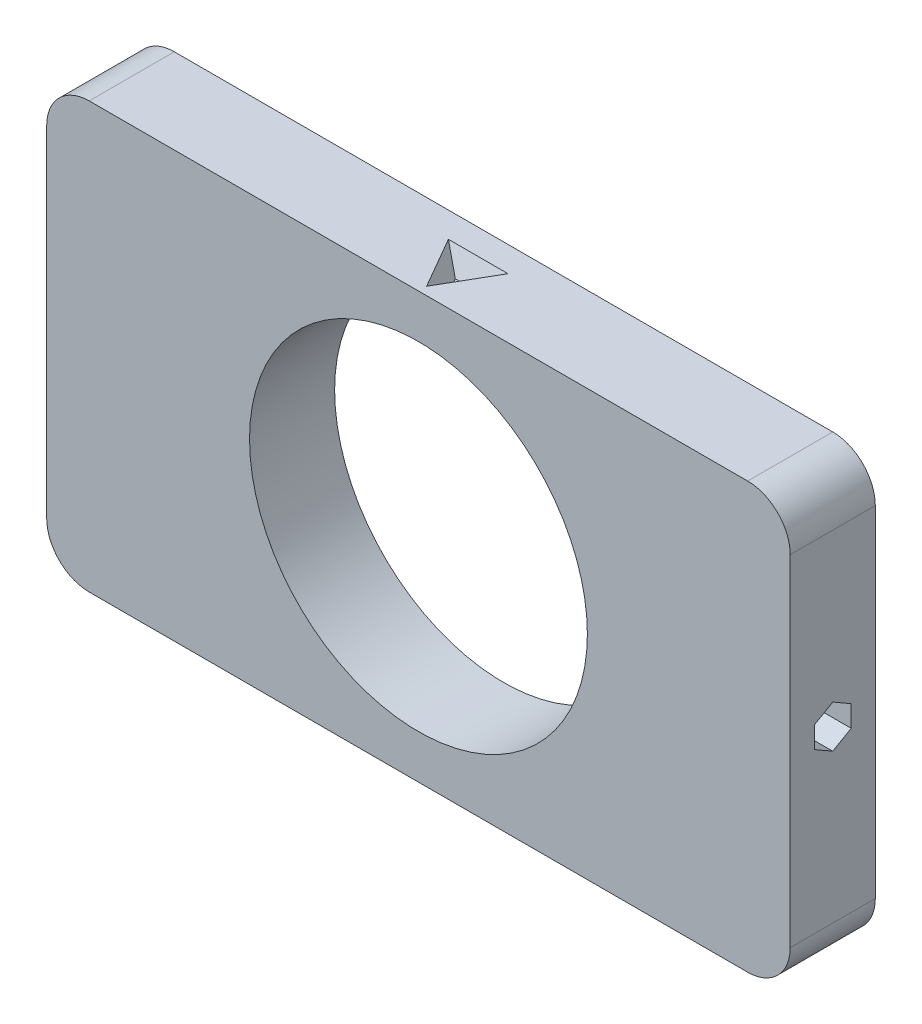
from build123d import *

# Parameters (mm, degrees)
SKETCH1_R               = 39.705202959
BOSS_EXTRUDE1_DEPTH     = 20
CUT_EXTRUDE1_DEPTH      = 5
CUT_EXTRUDE1_DRAFT      = -24
CUT_EXTRUDE2_REACH      = 184.868
CUT_EXTRUDE2_END_RADIUS = 39.705202959


with BuildPart() as part:
    # Sketch1 → Boss-Extrude1 (new body)
    with BuildSketch(Plane.XY):
        with BuildLine():
            Line((77.380717994, -49.989899132), (-77.380717994, -49.989899132))
            ThreePointArc((-77.380717994, -49.989899132), (-84.451785806, -47.060966943), (-87.380717994, -39.989899132))
            Line((-87.380717994, -39.989899132), (-87.380717994, 39.989899132))
            ThreePointArc((-87.380717994, 39.989899132), (-84.451785806, 47.060966943), (-77.380717994, 49.989899132))
            Line((-77.380717994, 49.989899132), (77.380717994, 49.989899132))
            ThreePointArc((77.380717994, 49.989899132), (84.451785806, 47.060966943), (87.380717994, 39.989899132))
            Line((87.380717994, 39.989899132), (87.380717994, -39.989899132))
            ThreePointArc((87.380717994, -39.989899132), (84.451785806, -47.060966943), (77.380717994, -49.989899132))
        make_face()
        Circle(SKETCH1_R, mode=Mode.SUBTRACT)
    extrude(amount=BOSS_EXTRUDE1_DEPTH)


with BuildPart() as cut_extrude1_tool:
    # Sketch2 → Cut-Extrude1 (with draft: the straight prism first)
    with BuildSketch(Plane(origin=(0, 49.989899132, 0), x_dir=(1, 0, 0), z_dir=(0, 1, 0))):
        Polygon((0, -18.082903769), (7, -5.958548116), (-7, -5.958548116), align=None)
    extrude(amount=-CUT_EXTRUDE1_DEPTH)
    # Cut-Extrude1: the draft: its side faces are tilted about the plane it starts from
    cut_extrude1_sides = [cut_extrude1_tool.faces().sort_by_distance(p)[0] for p in [
        (3.5, 47.489899132, 12.020725942),
        (0, 47.489899132, 5.958548116),
        (-3.5, 47.489899132, 12.020725942),
    ]]
    draft(cut_extrude1_sides, Plane(origin=(0, 49.989899132, 0), x_dir=(1, 0, 0), z_dir=(0, 1, 0)), CUT_EXTRUDE1_DRAFT)


with BuildPart() as part_1:
    add(part.part)

    # Cut-Extrude1: cut by cut_extrude1_tool
    add(cut_extrude1_tool.part, mode=Mode.SUBTRACT)

    # Cut-Extrude2: up to this cylinder (the profile starts outside it)
    cut_extrude2_end = Plane(origin=(0, 0, 10), z_dir=(0, 0, -1)) * Cylinder(CUT_EXTRUDE2_END_RADIUS, 450.146405919, mode=Mode.PRIVATE)
    # Sketch3 → Cut-Extrude2 (cut, up to the surface)
    with BuildSketch(Plane(origin=(87.380717994, 0, 0), x_dir=(0, 0, -1), z_dir=(1, 0, 0)), mode=Mode.PRIVATE) as cut_extrude2_sk1:
        Polygon((-10, 5), (-14.330127019, 2.5), (-14.330127019, -2.5), (-10, -5), (-5.669872981, -2.5), (-5.669872981, 2.5), align=None)
    cut_extrude2_tool1 = extrude(cut_extrude2_sk1.sketch, amount=-CUT_EXTRUDE2_REACH, mode=Mode.PRIVATE) - cut_extrude2_end
    add(cut_extrude2_tool1.solids().sort_by_distance((87.380718, 0, 10))[0], mode=Mode.SUBTRACT)


solid = part_1.part
